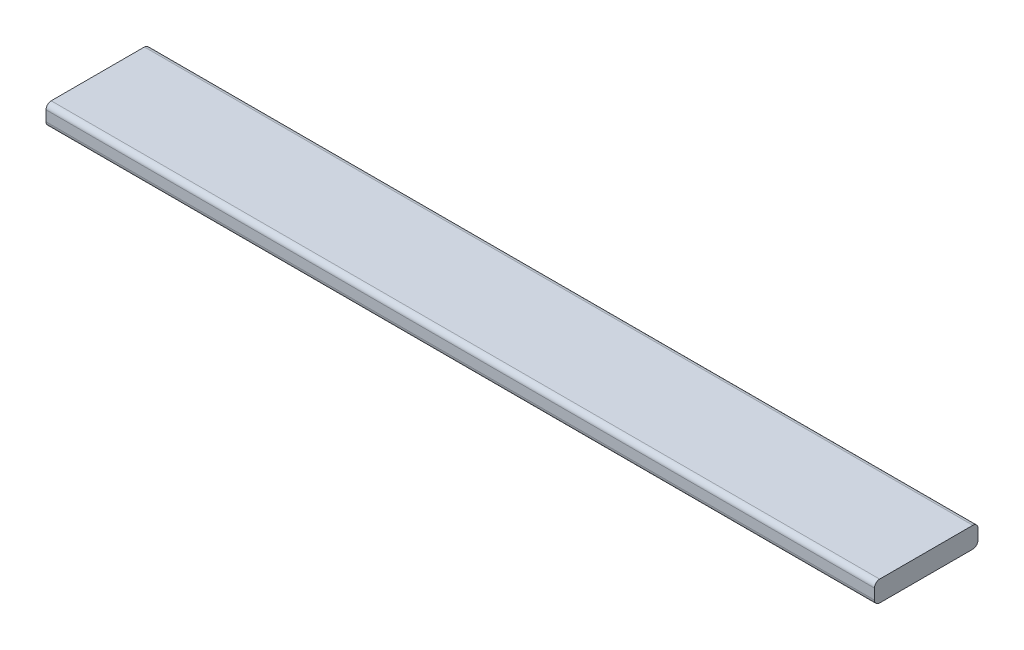
from build123d import *

# Parameters (mm, degrees)
SKETCH_1_W      = 120
SKETCH_1_H      = 15
EXTRUDE_1_DEPTH = 1.5
FILLET_1_R      = 0.75


with BuildPart() as part:
    # ｽｹｯﾁ1 → ﾎﾞｽ - 押し出し1 (new, symmetric)
    with BuildSketch(Plane(origin=(0, 0, 0), x_dir=(1, 0, 0), z_dir=(0, 1, 0))):
        Rectangle(SKETCH_1_W, SKETCH_1_H)
    extrude(amount=EXTRUDE_1_DEPTH, both=True)

    # ﾌｨﾚｯﾄ1
    fillet_1_edges = [part.edges().sort_by_distance(p)[0] for p in [
        (0, 1.5, 7.5),
        (0, -1.5, 7.5),
        (0, -1.5, -7.5),
        (0, 1.5, -7.5),
    ]]
    fillet(fillet_1_edges, radius=FILLET_1_R)


solid = part.part
